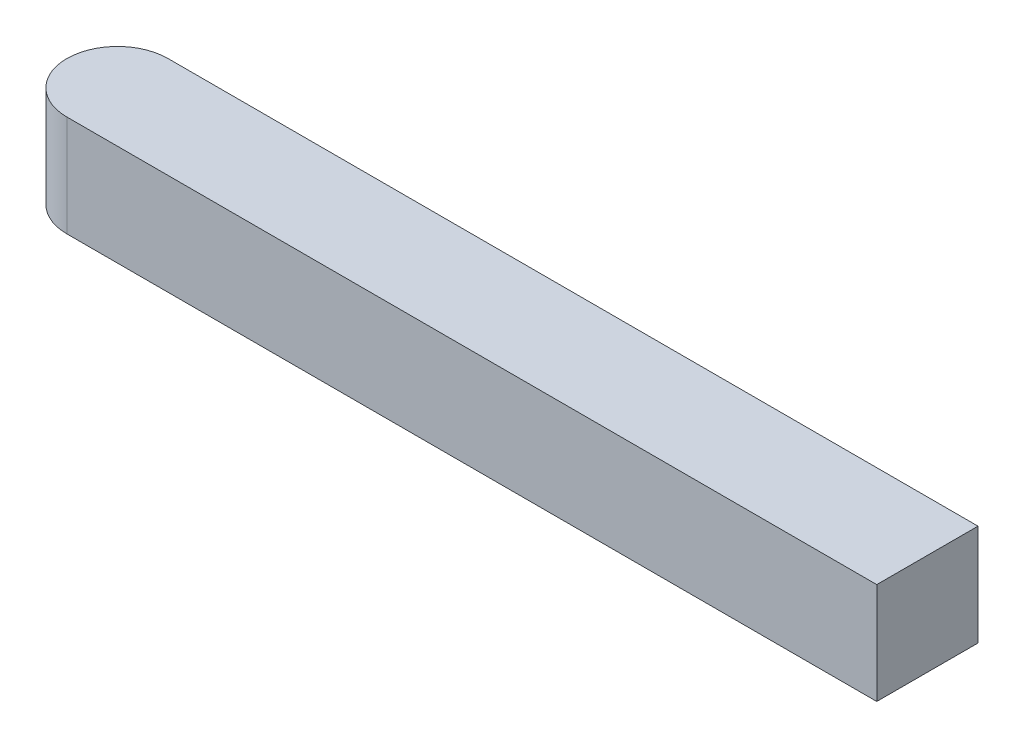
from build123d import *

# Parameters (mm, degrees)
BOSS_EXTRUDE1_DEPTH = 4


with BuildPart() as part:
    # Sketch1 → Boss-Extrude1 (new body)
    with BuildSketch(Plane(origin=(0, 0, 0), x_dir=(1, 0, 0), z_dir=(0, 1, 0))):
        with BuildLine():
            Line((0, 2), (-32, 2))
            ThreePointArc((-32, 2), (-34, 0), (-32, -2))
            Line((-32, -2), (0, -2))
            Line((0, -2), (0, 2))
        make_face()
    extrude(amount=BOSS_EXTRUDE1_DEPTH)


solid = part.part
